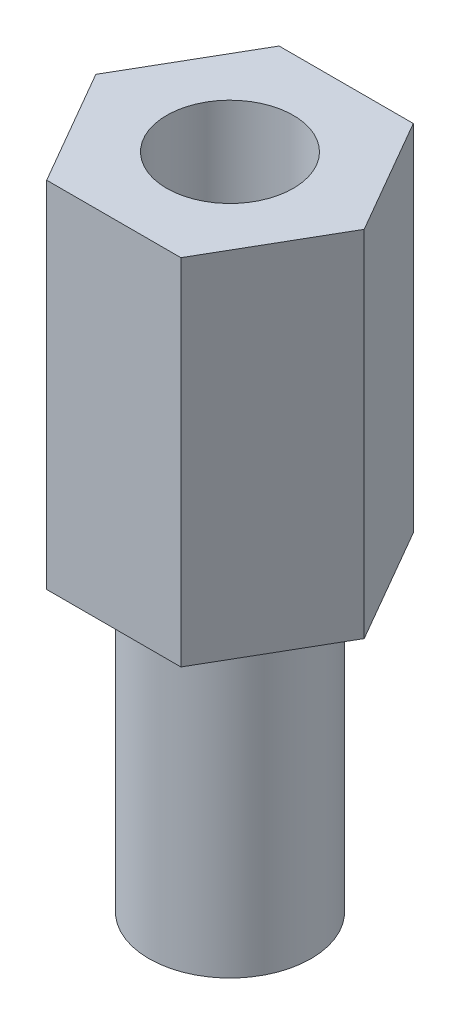
from build123d import *

# Parameters (mm, degrees)
EXTRUDE_1_DEPTH     = 7
SKETCH_6_R          = 1.6
EXTRUDE_2_DEPTH     = 6
SKETCH_7_R          = 1.25
CUT_EXTRUDE_1_DEPTH = 5


with BuildPart() as part:
    # 草图4 → 凸台-拉伸1 (new body)
    with BuildSketch(Plane(origin=(0, 0, 0), x_dir=(1, 0, 0), z_dir=(0, 1, 0))):
        Polygon((1.325, -2.29496732), (2.65, 0), (1.325, 2.29496732), (-1.325, 2.29496732), (-2.65, 0), (-1.325, -2.29496732), align=None)
    extrude(amount=EXTRUDE_1_DEPTH)

    # 草图6 → 凸台-拉伸2 (add)
    with BuildSketch(Plane(origin=(0, 0, 0), x_dir=(-1, 0, 0), z_dir=(0, -1, 0))):
        with Locations(Location((0, 0, 0), (0, 0, 270))):
            Circle(SKETCH_6_R)
    extrude(amount=EXTRUDE_2_DEPTH)

    # 草图7 → 切除-拉伸1 (cut)
    with BuildSketch(Plane(origin=(0, 7, 0), x_dir=(1, 0, 0), z_dir=(0, 1, 0))):
        with Locations(Location((0, 0, 0), (0, 0, 270))):
            Circle(SKETCH_7_R)
    extrude(amount=-CUT_EXTRUDE_1_DEPTH, mode=Mode.SUBTRACT)


solid = part.part
